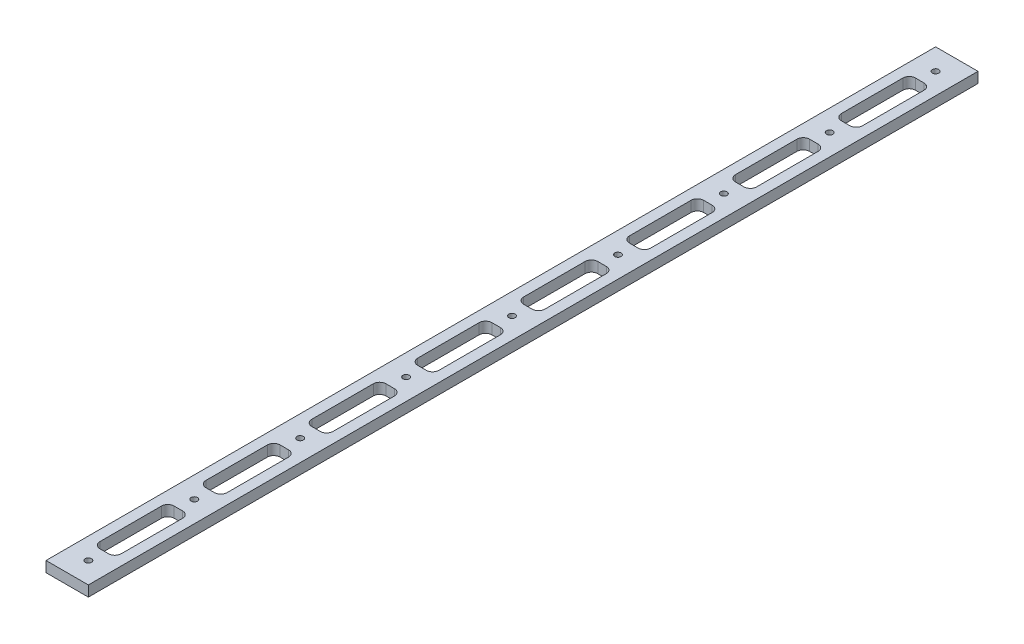
from build123d import *

# Parameters (mm, degrees)
SKETCH_1_W          = 20
SKETCH_1_H          = 420
EXTRUDE_1_DEPTH     = 5
SKETCH_2_R          = 1.5
CUT_EXTRUDE_1_DEPTH = 211.297408448
SKETCH_3_W          = 10
SKETCH_3_H          = 35
CUT_EXTRUDE_2_DEPTH = 211.297408448
FILLET_1_R          = 3


with BuildPart() as part:
    # 草图1 → 凸台-拉伸1 (new body)
    with BuildSketch(Plane(origin=(0, 0, 0), x_dir=(1, 0, 0), z_dir=(0, 1, 0))):
        Rectangle(SKETCH_1_W, SKETCH_1_H)
    extrude(amount=EXTRUDE_1_DEPTH)

    # 草图2 → 切除-拉伸1 (cut, through all)
    with BuildSketch(Plane(origin=(0, 5, 0), x_dir=(1, 0, 0), z_dir=(0, 1, 0))):
        with Locations(Location((0, 0, 0), (0, 0, 270))):
            Circle(SKETCH_2_R)
        with Locations(Location((0, 50, 0), (0, 0, 270))):
            Circle(SKETCH_2_R)
        with Locations(Location((0, 100, 0), (0, 0, 270))):
            Circle(SKETCH_2_R)
        with Locations(Location((0, 150, 0), (0, 0, 270))):
            Circle(SKETCH_2_R)
        with Locations(Location((0, 200, 0), (0, 0, 270))):
            Circle(SKETCH_2_R)
        with Locations(Location((0, -200, 0), (0, 0, 90))):
            Circle(SKETCH_2_R)
        with Locations(Location((0, -150, 0), (0, 0, 90))):
            Circle(SKETCH_2_R)
        with Locations(Location((0, -100, 0), (0, 0, 90))):
            Circle(SKETCH_2_R)
        with Locations(Location((0, -50, 0), (0, 0, 90))):
            Circle(SKETCH_2_R)
    extrude(amount=-CUT_EXTRUDE_1_DEPTH, mode=Mode.SUBTRACT)

    # 草图3 → 切除-拉伸2 (cut, through all)
    with BuildSketch(Plane(origin=(0, 5, 0), x_dir=(1, 0, 0), z_dir=(0, 1, 0))):
        with Locations((0, 125)):
            Rectangle(SKETCH_3_W, SKETCH_3_H)
        with Locations((0, 175)):
            Rectangle(SKETCH_3_W, SKETCH_3_H)
        with Locations((0, 75)):
            Rectangle(SKETCH_3_W, SKETCH_3_H)
        with Locations((0, 25)):
            Rectangle(SKETCH_3_W, SKETCH_3_H)
        with Locations((0, -25)):
            Rectangle(SKETCH_3_W, SKETCH_3_H)
        with Locations((0, -75)):
            Rectangle(SKETCH_3_W, SKETCH_3_H)
        with Locations((0, -125)):
            Rectangle(SKETCH_3_W, SKETCH_3_H)
        with Locations((0, -175)):
            Rectangle(SKETCH_3_W, SKETCH_3_H)
    extrude(amount=-CUT_EXTRUDE_2_DEPTH, mode=Mode.SUBTRACT)

    # 圆角1
    fillet_1_edges = [part.edges().sort_by_distance(p)[0] for p in [
        (-5, 2.5, -42.5),
        (5, 2.5, -42.5),
        (5, 2.5, -7.5),
        (-5, 2.5, -7.5),
        (-5, 2.5, 7.5),
        (5, 2.5, 7.5),
        (5, 2.5, 42.5),
        (-5, 2.5, 42.5),
        (-5, 2.5, 57.5),
        (5, 2.5, 57.5),
        (5, 2.5, 92.5),
        (-5, 2.5, 92.5),
        (-5, 2.5, 107.5),
        (5, 2.5, 107.5),
        (5, 2.5, 142.5),
        (-5, 2.5, 142.5),
        (-5, 2.5, 157.5),
        (5, 2.5, 157.5),
        (5, 2.5, 192.5),
        (-5, 2.5, 192.5),
        (5, 2.5, -192.5),
        (5, 2.5, -157.5),
        (-5, 2.5, -157.5),
        (-5, 2.5, -192.5),
        (-5, 2.5, -142.5),
        (5, 2.5, -142.5),
        (5, 2.5, -107.5),
        (-5, 2.5, -107.5),
        (-5, 2.5, -92.5),
        (5, 2.5, -92.5),
        (5, 2.5, -57.5),
        (-5, 2.5, -57.5),
    ]]
    fillet(fillet_1_edges, radius=FILLET_1_R)


solid = part.part
